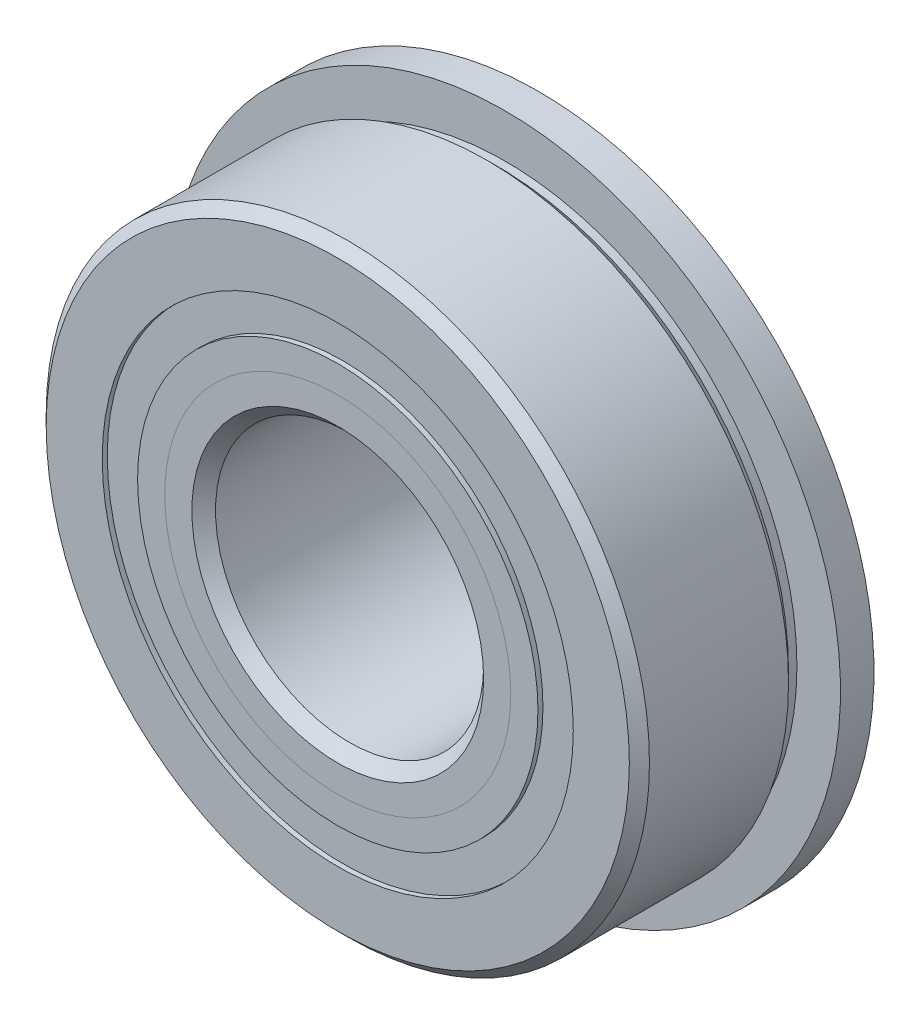
from build123d import *

# Parameters (mm, degrees)
SKETCH5_W         = 1.5875
SKETCH5_H         = 3.391318681
CIRPATTERN1_COUNT = 12
SKETCH7_W         = 1.677034196
SKETCH7_H         = 1.674725274
SKETCH7_H_2       = 2.418512637


with BuildPart() as part:
    # Sketch1 → Revolve1 (revolve)
    with BuildSketch(Plane(origin=(0, 0, 0), x_dir=(0, 0, -1), z_dir=(1, 0, 0))):
        with BuildLine():
            Line((4.28625, 14.2875), (-4.28625, 14.2875))
            Line((-4.28625, 14.2875), (-4.7625, 13.81125))
            Line((-4.7625, 13.81125), (-4.7625, 11.156112637))
            Line((-4.7625, 11.156112637), (-2.721428571, 11.156112637))
            ThreePointArc((-2.721428571, 11.156112637), (0, 13.166090804), (2.721428571, 11.156112637))
            Line((2.721428571, 11.156112637), (4.7625, 11.156112637))
            Line((4.7625, 11.156112637), (4.7625, 13.81125))
            Line((4.7625, 13.81125), (4.28625, 14.2875))
        make_face()
    revolve(axis=Axis((0, 0, 4.7625), (0, 0, -1)))

    # Sketch5 → Revolve5 (revolve)
    with BuildSketch(Plane(origin=(0, 0, 0), x_dir=(0, 0, -1), z_dir=(1, 0, 0))):
        with Locations((3.96875, 14.17934066)):
            Rectangle(SKETCH5_W, SKETCH5_H)
    revolve(axis=Axis((0, 0, -6.35), (0, 0, 1)))

    # Sketch6 → Cut-Revolve1 (revolve, cut)
    with BuildSketch(Plane(origin=(0, 0, 0), x_dir=(0, 0, -1), z_dir=(1, 0, 0))):
        Polygon((2.301875, 14.2875), (2.778125, 13.81125), (3.175, 13.81125), (3.175, 14.2875), align=None)
    revolve(axis=Axis((0, 0, 4.7625), (0, 0, -1)), mode=Mode.SUBTRACT)


with BuildPart() as body_2:
    # Sketch2 → Revolve2 (revolve)
    with BuildSketch(Plane(origin=(0, 0, 0), x_dir=(0, 0, -1), z_dir=(1, 0, 0))):
        with BuildLine():
            Line((-4.7625, 9.481387363), (-2.721428571, 9.481387363))
            ThreePointArc((-2.721428571, 9.481387363), (-1.691610601, 8.028378146), (0, 7.471409196))
            Line((0, 7.471409196), (0, 6.910704598))
            Line((0, 6.910704598), (-3.477158618, 6.910704598))
            Line((-3.477158618, 6.910704598), (-4.7625, 8.19604598))
            Line((-4.7625, 8.19604598), (-4.7625, 9.481387363))
        make_face()
    revolve(axis=Axis((0, 0, 4.7625), (0, 0, -1)))


with BuildPart() as body_3:
    # Sketch3 → Revolve3 (revolve)
    with BuildSketch(Plane(origin=(0, 0, 0), x_dir=(0, 0, -1), z_dir=(1, 0, 0))):
        with BuildLine():
            Line((-4.7625, 8.19604598), (-3.477158618, 6.910704598))
            Line((-3.477158618, 6.910704598), (0, 6.910704598))
            Line((0, 6.910704598), (0, 7.471409196))
            ThreePointArc((0, 7.471409196), (1.342623689, 7.807831585), (2.367976844, 8.7376))
            Line((2.367976844, 8.7376), (6.35, 8.7376))
            Line((6.35, 8.7376), (6.35, 6.82625))
            Line((6.35, 6.82625), (5.87375, 6.35))
            Line((5.87375, 6.35), (-4.201795402, 6.35))
            Line((-4.201795402, 6.35), (-4.7625, 6.910704598))
            Line((-4.7625, 6.910704598), (-4.7625, 8.19604598))
        make_face()
    revolve(axis=Axis((0, 0, 4.7625), (0, 0, -1)))


with BuildPart() as body_4:
    # Sketch4 → Revolve4 (revolve)
    with BuildSketch(Plane(origin=(0, 0, 0), x_dir=(0, 0, -1), z_dir=(1, 0, 0))):
        with BuildLine():
            Line((-2.847340804, 10.31875), (2.847340804, 10.31875))
            ThreePointArc((2.847340804, 10.31875), (0, 13.166090804), (-2.847340804, 10.31875))
        make_face()
    revolve(axis=Axis((0, 10.31875, 2.847340804), (0, 0, -1)))


with BuildPart() as cirpattern1_1:
    # CirPattern1: pattern copy
    add(body_4.part.rotate(Axis((0, 0, -4.7625), (0, 0, 1)), 1 * 360 / CIRPATTERN1_COUNT))


with BuildPart() as cirpattern1_2:
    # CirPattern1: pattern copy
    add(body_4.part.rotate(Axis((0, 0, -4.7625), (0, 0, 1)), 2 * 360 / CIRPATTERN1_COUNT))


with BuildPart() as cirpattern1_3:
    # CirPattern1: pattern copy
    add(body_4.part.rotate(Axis((0, 0, -4.7625), (0, 0, 1)), 3 * 360 / CIRPATTERN1_COUNT))


with BuildPart() as cirpattern1_4:
    # CirPattern1: pattern copy
    add(body_4.part.rotate(Axis((0, 0, -4.7625), (0, 0, 1)), 4 * 360 / CIRPATTERN1_COUNT))


with BuildPart() as cirpattern1_5:
    # CirPattern1: pattern copy
    add(body_4.part.rotate(Axis((0, 0, -4.7625), (0, 0, 1)), 5 * 360 / CIRPATTERN1_COUNT))


with BuildPart() as cirpattern1_6:
    # CirPattern1: pattern copy
    add(body_4.part.rotate(Axis((0, 0, -4.7625), (0, 0, 1)), 6 * 360 / CIRPATTERN1_COUNT))


with BuildPart() as cirpattern1_7:
    # CirPattern1: pattern copy
    add(body_4.part.rotate(Axis((0, 0, -4.7625), (0, 0, 1)), 7 * 360 / CIRPATTERN1_COUNT))


with BuildPart() as cirpattern1_8:
    # CirPattern1: pattern copy
    add(body_4.part.rotate(Axis((0, 0, -4.7625), (0, 0, 1)), 8 * 360 / CIRPATTERN1_COUNT))


with BuildPart() as cirpattern1_9:
    # CirPattern1: pattern copy
    add(body_4.part.rotate(Axis((0, 0, -4.7625), (0, 0, 1)), 9 * 360 / CIRPATTERN1_COUNT))


with BuildPart() as cirpattern1_10:
    # CirPattern1: pattern copy
    add(body_4.part.rotate(Axis((0, 0, -4.7625), (0, 0, 1)), 10 * 360 / CIRPATTERN1_COUNT))


with BuildPart() as cirpattern1_11:
    # CirPattern1: pattern copy
    add(body_4.part.rotate(Axis((0, 0, -4.7625), (0, 0, 1)), 11 * 360 / CIRPATTERN1_COUNT))


with BuildPart() as body_16:
    # Sketch7 → Revolve6 (revolve)
    with BuildSketch(Plane(origin=(0, 0, 0), x_dir=(0, 0, -1), z_dir=(1, 0, 0))):
        with Locations((-3.685857902, 10.31875)):
            Rectangle(SKETCH7_W, SKETCH7_H)
        with Locations((3.685857902, 9.946856319)):
            Rectangle(SKETCH7_W, SKETCH7_H_2)
    revolve(axis=Axis((0, 0, 4.7625), (0, 0, -1)))


solid = Compound([part.part, body_2.part, body_3.part, body_4.part, cirpattern1_1.part, cirpattern1_2.part, cirpattern1_3.part, cirpattern1_4.part, cirpattern1_5.part, cirpattern1_6.part, cirpattern1_7.part, cirpattern1_8.part, cirpattern1_9.part, cirpattern1_10.part, cirpattern1_11.part, body_16.part])
